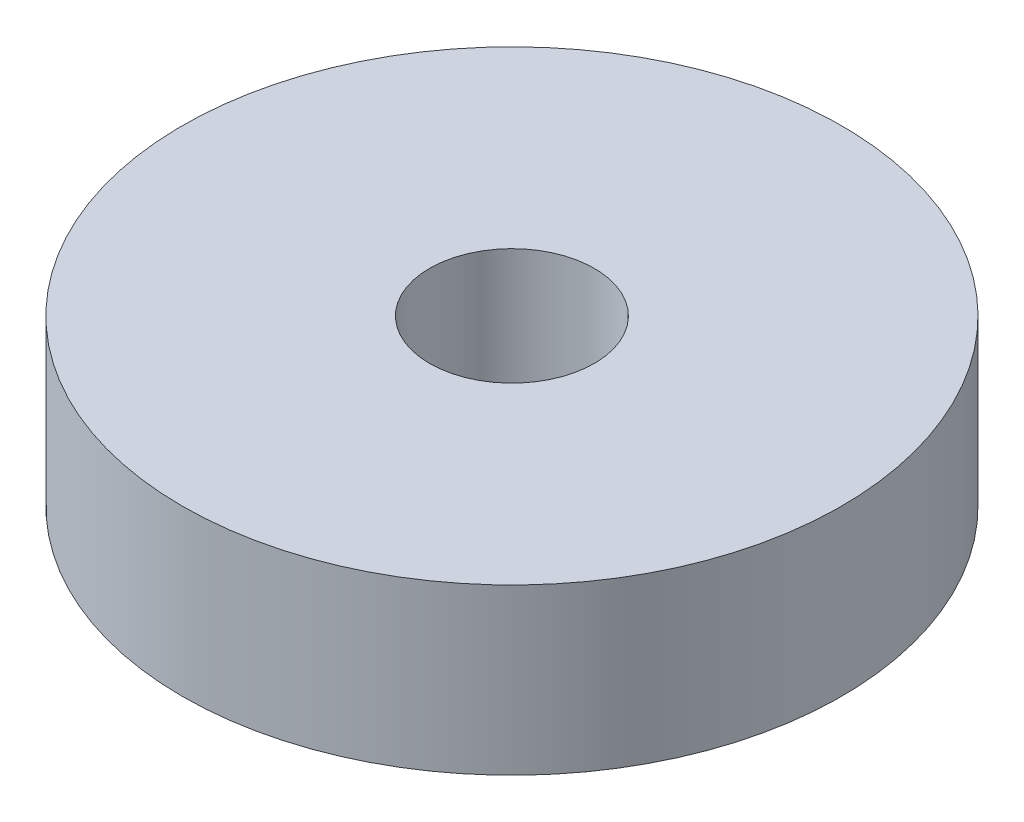
from build123d import *

# Parameters (mm, degrees)
SKETCH1_R           = 10
SKETCH1_R_2         = 2.5
BOSS_EXTRUDE1_DEPTH = 5


with BuildPart() as part:
    # Sketch1 → Boss-Extrude1 (new body)
    with BuildSketch(Plane(origin=(0, 0, 0), x_dir=(1, 0, 0), z_dir=(0, 1, 0))):
        with Locations(Location((0, 0, 0), (0, 0, 270))):
            Circle(SKETCH1_R)
        with Locations(Location((0, 0, 0), (0, 0, 270))):
            Circle(SKETCH1_R_2, mode=Mode.SUBTRACT)
    extrude(amount=BOSS_EXTRUDE1_DEPTH)


solid = part.part
